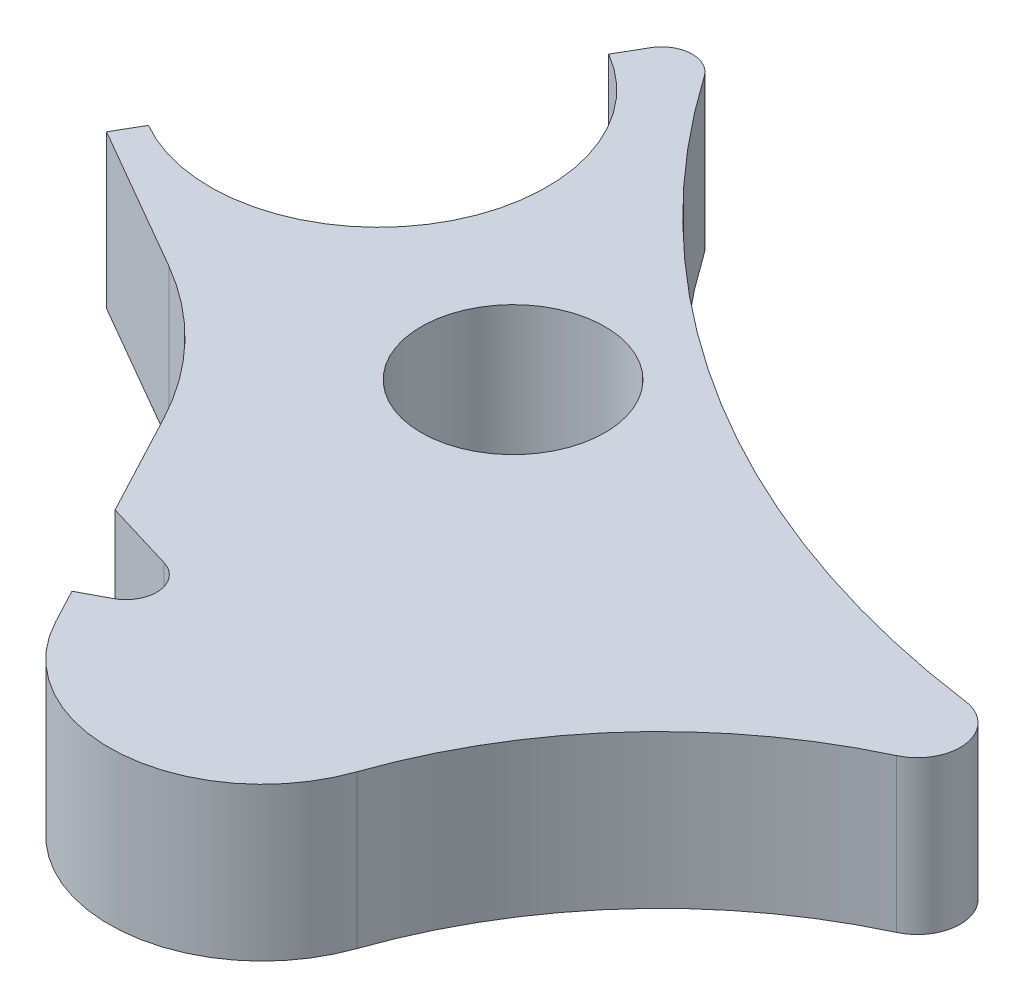
from build123d import *

# Parameters (mm, degrees)
SKETCH_1_R      = 15
EXTRUDE_1_DEPTH = 12.5
FILLET_1_R      = 5


with BuildPart() as part:
    # 草图1 → 凸台-拉伸1 (new, symmetric)
    with BuildSketch(Plane(origin=(0, 0, 0), x_dir=(1, 0, 0), z_dir=(0, 1, 0))):
        with BuildLine():
            Line((-6.096427139, -65.918001187), (-1.679569826, -63.574633635))
            ThreePointArc((-1.679569826, -63.574633635), (0.953470582, -58.672633233), (-2.576772207, -54.371482736))
            Line((-2.576772207, -54.371482736), (-14.063876814, -50.900686325))
            Line((-14.063876814, -50.900686325), (-23.098048547, -33.872778153))
            ThreePointArc((-23.098048547, -33.872778153), (-32.102531801, -21.461490279), (-44.183478984, -12.018424012))
            Line((-44.183478984, -12.018424012), (-68.211524227, 1.854174377))
            Line((-68.211524227, 1.854174377), (-65.711524227, 6.184301396))
            ThreePointArc((-65.711524227, 6.184301396), (-28.145825623, 16.25), (-38.211524227, 53.815698604))
            Line((-38.211524227, 53.815698604), (-31.672954916, 65.14083286))
            ThreePointArc((-31.672954916, 65.14083286), (17.174057589, 15.576162499), (82.442373664, -8.563723486))
            ThreePointArc((82.442373664, -8.563723486), (88.420562961, -14.448425798), (84.460192724, -21.843284562))
            ThreePointArc((84.460192724, -21.843284562), (58.872866338, -40.770350543), (42.68980144, -68.175706017))
            ThreePointArc((42.68980144, -68.175706017), (20.995404286, -84.925315775), (-3.01984927, -71.716837758))
            Line((-3.01984927, -71.716837758), (-6.096427139, -65.918001187))
        make_face()
        with Locations(Location((0, 0, 0), (0, 0, 270))):
            Circle(SKETCH_1_R, mode=Mode.SUBTRACT)
    extrude(amount=EXTRUDE_1_DEPTH, both=True)

    # 圆角1
    fillet_1_edges = [part.edges().sort_by_distance(p)[0] for p in [
        (-31.672954916, 0, -65.14083286),
    ]]
    fillet(fillet_1_edges, radius=FILLET_1_R)


solid = part.part
